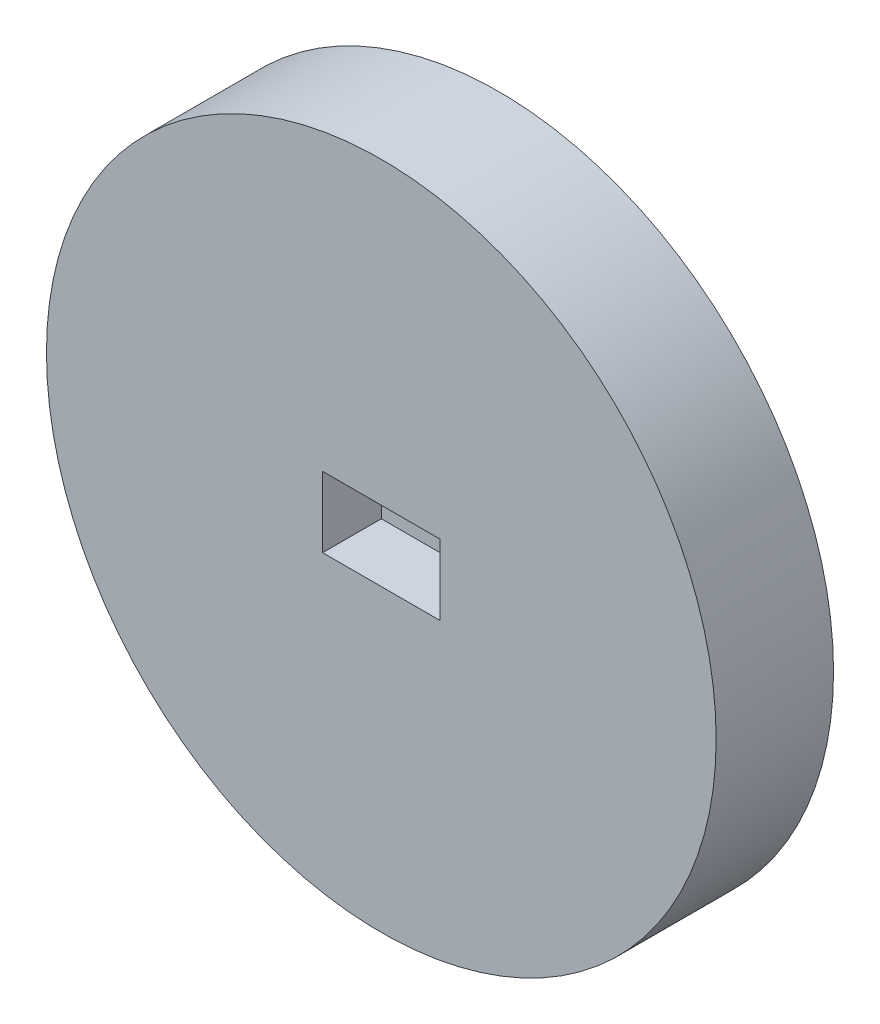
from build123d import *

# Parameters (mm, degrees)
SCHIZZO1_R                   = 28.525234369
ESTRUSIONE_ESTRUSIONE2_DEPTH = 5
SCHIZZO4_W                   = 10
SCHIZZO4_H                   = 6
TAGLIO_ESTRUSIONE1_DEPTH     = 5


with BuildPart() as part:
    # Schizzo1 → Estrusione-Estrusione2 (new, symmetric)
    with BuildSketch(Plane.XY):
        Circle(SCHIZZO1_R)
    extrude(amount=ESTRUSIONE_ESTRUSIONE2_DEPTH, both=True)

    # Schizzo4 → Taglio-Estrusione1 (cut, symmetric)
    with BuildSketch(Plane.XY.offset(5)):
        Rectangle(SCHIZZO4_W, SCHIZZO4_H)
    extrude(amount=TAGLIO_ESTRUSIONE1_DEPTH, both=True, mode=Mode.SUBTRACT)


solid = part.part
